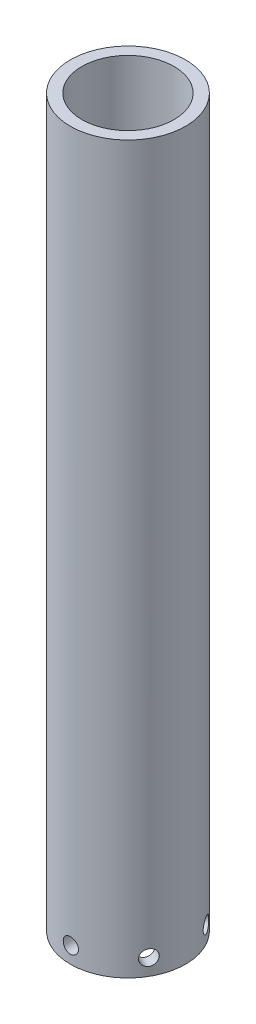
from build123d import *

# Parameters (mm, degrees)
SKETCH1_R           = 15.875
SKETCH1_R_2         = 12.7
BOSS_EXTRUDE1_DEPTH = 100
SKETCH2_R           = 2.1
CUT_EXTRUDE1_DEPTH  = 103.489176258
CIRPATTERN1_COUNT   = 6


with BuildPart() as part:
    # Sketch1 → Boss-Extrude1 (new, symmetric)
    with BuildSketch(Plane(origin=(0, 0, 0), x_dir=(1, 0, 0), z_dir=(0, 1, 0))):
        with Locations(Location((0, 0, 0), (0, 0, 270))):
            Circle(SKETCH1_R)
        with Locations(Location((0, 0, 0), (0, 0, 270))):
            Circle(SKETCH1_R_2, mode=Mode.SUBTRACT)
    extrude(amount=BOSS_EXTRUDE1_DEPTH, both=True)

    # Sketch2 → Cut-Extrude1 (cut, through all)
    with BuildSketch(Plane.XY):
        with Locations(Location((0, -95.5, 0), (0, 0, 90))):
            Circle(SKETCH2_R)
    cut_extrude1 = extrude(amount=-CUT_EXTRUDE1_DEPTH, mode=Mode.SUBTRACT)

    # CirPattern1: Cut-Extrude1 ×6 about axis
    cirpattern1_axis = Axis((0, 100, 0), (0, -1, 0))
    for i in range(1, CIRPATTERN1_COUNT):
        add(cut_extrude1.rotate(cirpattern1_axis, i * 360 / CIRPATTERN1_COUNT), mode=Mode.SUBTRACT)


solid = part.part
